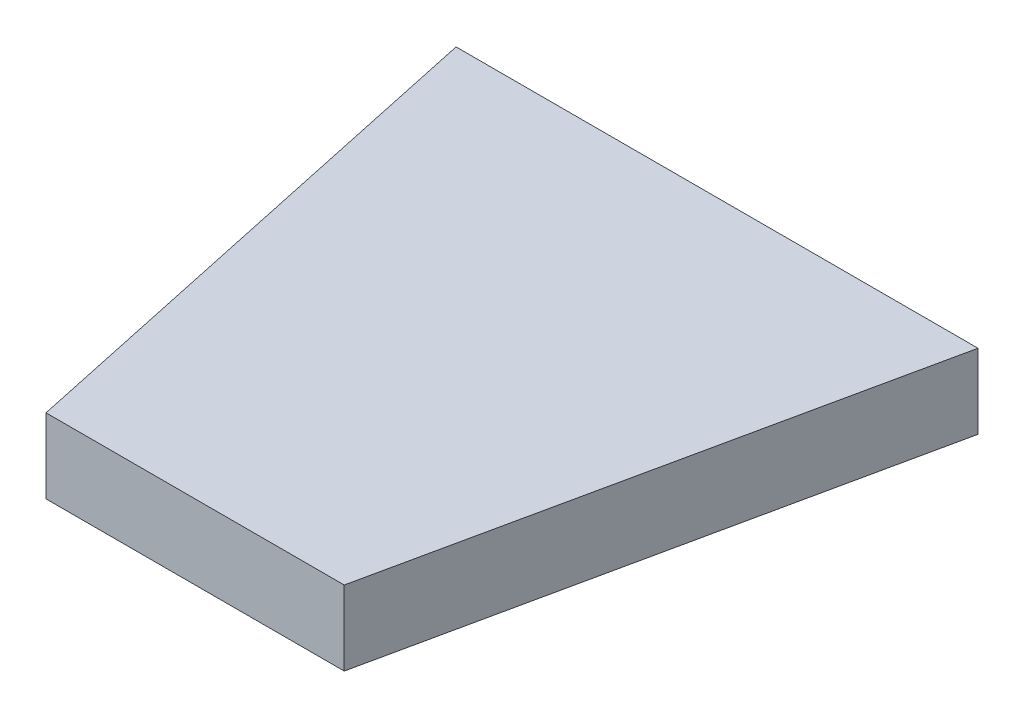
from build123d import *

# Parameters (mm, degrees)
BOSS_EXTRUDE1_DEPTH = 10


with BuildPart() as part:
    # Sketch1 → Boss-Extrude1 (new body)
    with BuildSketch(Plane(origin=(0, 0, 0), x_dir=(1, 0, 0), z_dir=(0, 1, 0))):
        Polygon((-35, 35), (-20, -35), (20, -35), (35, 35), align=None)
    extrude(amount=BOSS_EXTRUDE1_DEPTH)


solid = part.part
